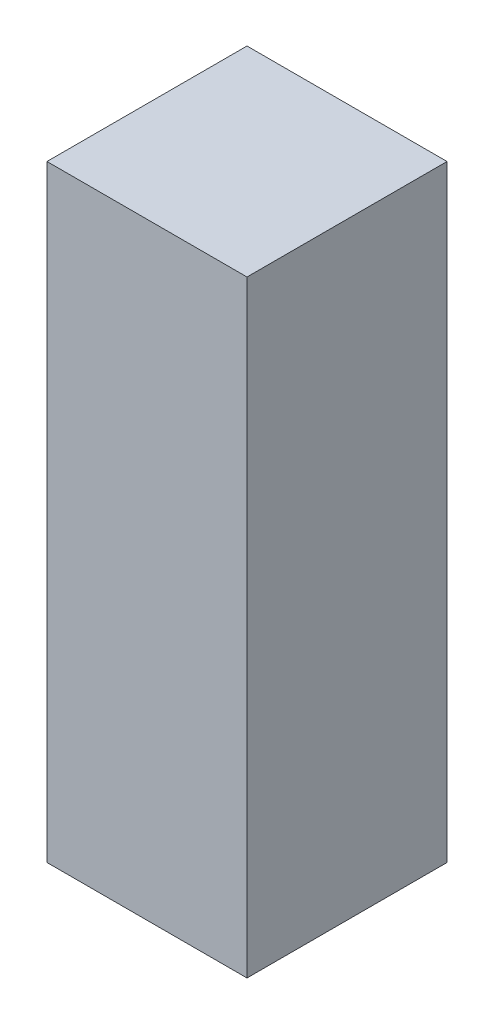
from build123d import *

# Parameters (mm, degrees)
SKETCH1_W           = 100
SKETCH1_H           = 100
BOSS_EXTRUDE1_DEPTH = 303.5


with BuildPart() as part:
    # Sketch1 → Boss-Extrude1 (new body)
    with BuildSketch(Plane(origin=(0, 0, 0), x_dir=(1, 0, 0), z_dir=(0, 1, 0))):
        Rectangle(SKETCH1_W, SKETCH1_H)
    extrude(amount=BOSS_EXTRUDE1_DEPTH)


solid = part.part
